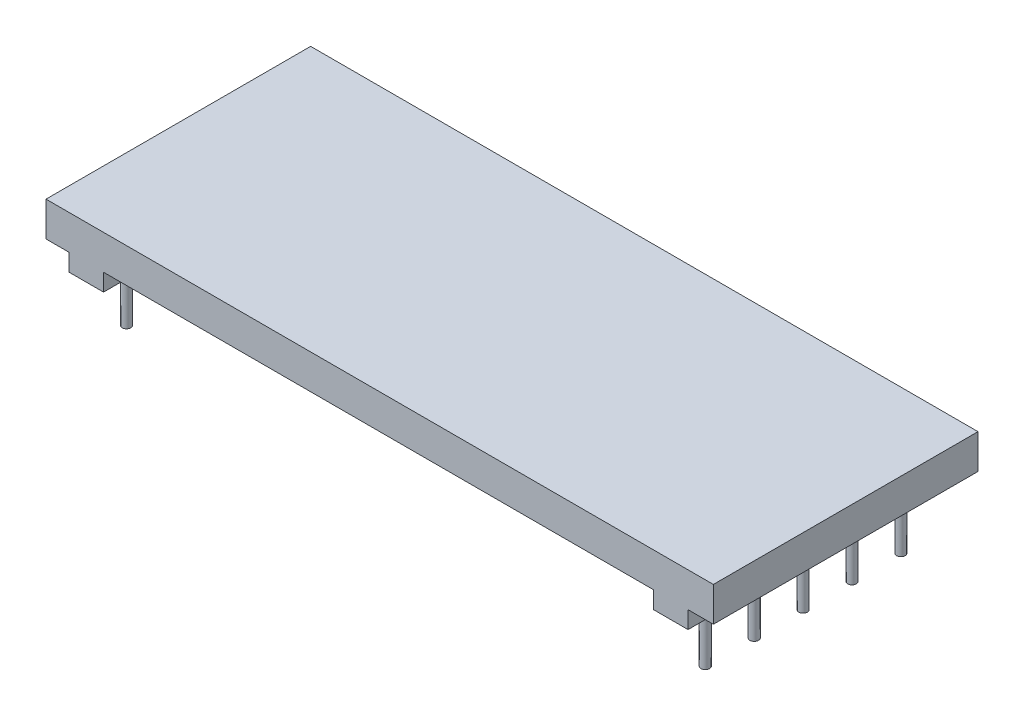
from build123d import *

# Parameters (mm, degrees)
SKETCH1_W           = 58
SKETCH1_H           = 23
BOSS_EXTRUDE1_DEPTH = 3
SKETCH2_W           = 3
SKETCH2_H           = 23
BOSS_EXTRUDE2_DEPTH = 1.5
SKETCH3_R           = 0.375
BOSS_EXTRUDE3_DEPTH = 5
LPATTERN1_COUNT     = 2
LPATTERN1_PITCH     = 50.8
SKETCH4_R           = 0.375
BOSS_EXTRUDE4_DEPTH = 5


with BuildPart() as part:
    # Sketch1 → Boss-Extrude1 (new body)
    with BuildSketch(Plane(origin=(0, 0, 0), x_dir=(1, 0, 0), z_dir=(0, 1, 0))):
        Rectangle(SKETCH1_W, SKETCH1_H)
    extrude(amount=BOSS_EXTRUDE1_DEPTH)

    # Sketch2 → Boss-Extrude2 (add)
    with BuildSketch(Plane.XZ):
        with Locations((-25.5, 0)):
            Rectangle(SKETCH2_W, SKETCH2_H)
    boss_extrude2 = extrude(amount=BOSS_EXTRUDE2_DEPTH)

    # Sketch3 → Boss-Extrude3 (add)
    with BuildSketch(Plane.XZ.offset(1.5)):
        with Locations(Location((-25.5, 8, 0), (0, 0, 270))):
            Circle(SKETCH3_R)
        with Locations(Location((-25.5, 0, 0), (0, 0, 270))):
            Circle(SKETCH3_R)
        with Locations(Location((-25.5, -8, 0), (0, 0, 270))):
            Circle(SKETCH3_R)
    extrude(amount=BOSS_EXTRUDE3_DEPTH)

    # LPattern1: Boss-Extrude2 ×2
    with Locations(*[(i * LPATTERN1_PITCH, 0, 0) for i in range(1, LPATTERN1_COUNT)]):
        add(boss_extrude2)

    # Sketch4 → Boss-Extrude4 (add)
    with BuildSketch(Plane.XZ.offset(1.5)):
        with Locations(Location((25.3, 8.5, 0), (0, 0, 270))):
            Circle(SKETCH4_R)
        with Locations(Location((25.3, 4.25, 0), (0, 0, 270))):
            Circle(SKETCH4_R)
        with Locations(Location((25.3, 0, 0), (0, 0, 270))):
            Circle(SKETCH4_R)
        with Locations(Location((25.3, -4.25, 0), (0, 0, 270))):
            Circle(SKETCH4_R)
        with Locations(Location((25.3, -8.5, 0), (0, 0, 270))):
            Circle(SKETCH4_R)
    extrude(amount=BOSS_EXTRUDE4_DEPTH)


solid = part.part
